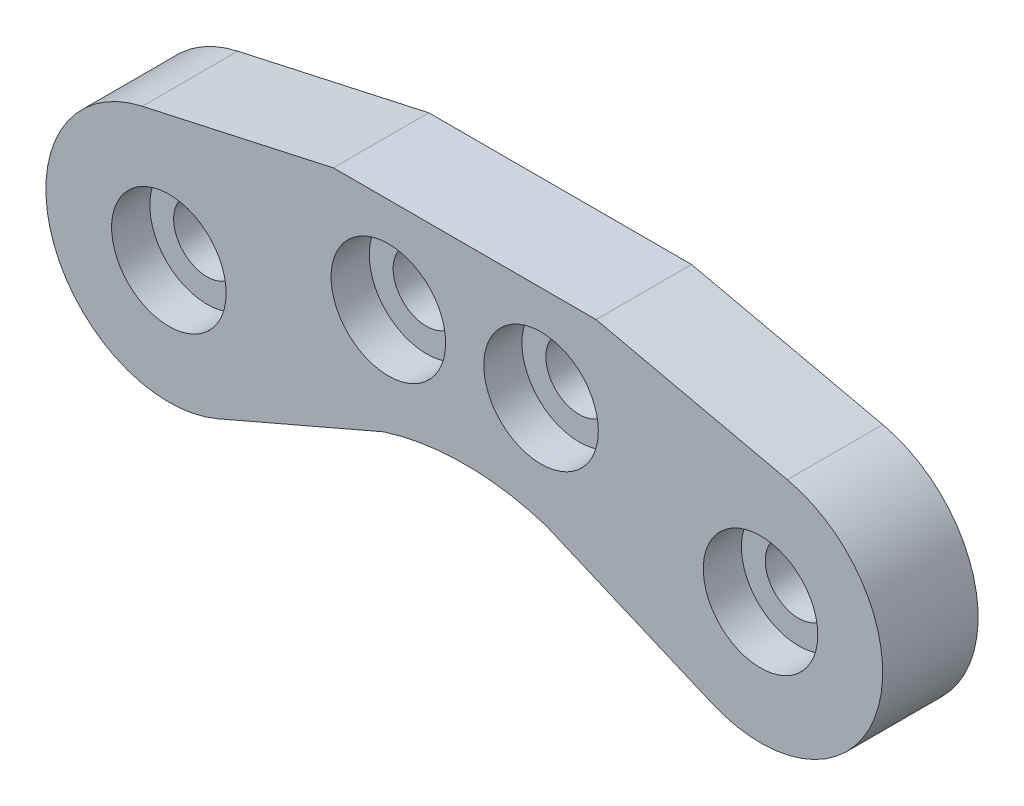
from build123d import *

# Parameters (mm, degrees)
BOSS_EXTRUDE1_DEPTH     = 5
CUT_EXTRUDE1_DEPTH      = 53.75142939
CUT_EXTRUDE1_DEPTH_BACK = 53.75142939
SKETCH2_R               = 1.75
SKETCH5_R               = 3
CUT_EXTRUDE2_DEPTH      = 2


with BuildPart() as part:
    # Sketch1 → Boss-Extrude1 (new body)
    with BuildSketch(Plane.XY):
        with BuildLine():
            Line((23.11684397, 8), (36.88315603, 8))
            Line((36.88315603, 8), (46.90520921, 5.744848006))
            ThreePointArc((46.90520921, 5.744848006), (51.591551748, -2.466147717), (42.989140572, -6.387981358))
            Line((42.989140572, -6.387981358), (34.244441462, -2.658908715))
            ThreePointArc((34.244441462, -2.658908715), (30, -2), (25.755558538, -2.658908715))
            Line((25.755558538, -2.658908715), (17.05409045, -6.415729603))
            ThreePointArc((17.05409045, -6.415729603), (8.36828995, -2.480244081), (13.111532947, 5.792169261))
            Line((13.111532947, 5.792169261), (23.11684397, 8))
        make_face()
    extrude(amount=BOSS_EXTRUDE1_DEPTH)

    # Sketch2 → Cut-Extrude1 (cut, two sides: drawn at the far end of the back side and taken through both)
    with BuildSketch(Plane.XY.offset(5).offset(-CUT_EXTRUDE1_DEPTH_BACK)):
        with Locations((45.5, -0.5)):
            Circle(SKETCH2_R)
        with Locations((14.5, -0.5)):
            Circle(SKETCH2_R)
        with Locations((26, 3)):
            Circle(SKETCH2_R)
        with Locations((34, 3)):
            Circle(SKETCH2_R)
    extrude(amount=CUT_EXTRUDE1_DEPTH + CUT_EXTRUDE1_DEPTH_BACK, mode=Mode.SUBTRACT)

    # Sketch5 → Cut-Extrude2 (cut)
    with BuildSketch(Plane.XY.offset(5)):
        with Locations((26, 3)):
            Circle(SKETCH5_R)
        with Locations((34, 3)):
            Circle(SKETCH5_R)
        with Locations((45.5, -0.5)):
            Circle(SKETCH5_R)
        with Locations((14.5, -0.5)):
            Circle(SKETCH5_R)
    extrude(amount=-CUT_EXTRUDE2_DEPTH, mode=Mode.SUBTRACT)


solid = part.part
